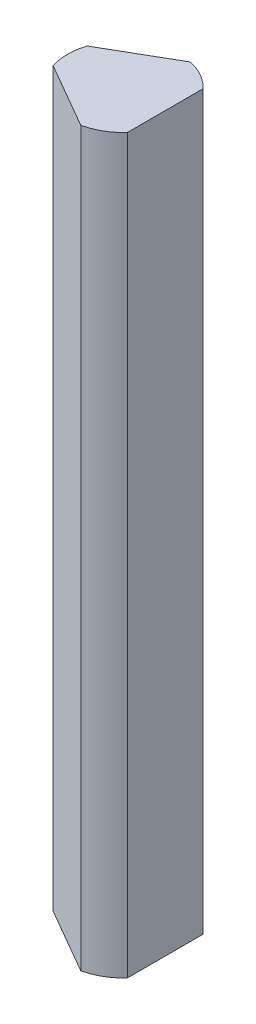
from build123d import *

# Parameters (mm, degrees)
RESSALTO_EXTRUS_O1_DEPTH = 30


with BuildPart() as part:
    # Esboço1 → Ressalto-extrusão1 (new body)
    with BuildSketch(Plane(origin=(0, 0, 0), x_dir=(1, 0, 0), z_dir=(0, 1, 0))):
        with BuildLine():
            Line((0.491640786, -2.246839856), (-2.191640786, -0.697646517))
            ThreePointArc((-2.191640786, -0.697646517), (-2.3, 0), (-2.191640786, 0.697646517))
            Line((-2.191640786, 0.697646517), (0.491640786, 2.246839856))
            ThreePointArc((0.491640786, 2.246839856), (1.15, 1.991858429), (1.7, 1.549193338))
            Line((1.7, 1.549193338), (1.7, -1.549193338))
            ThreePointArc((1.7, -1.549193338), (1.15, -1.991858429), (0.491640786, -2.246839856))
        make_face()
    extrude(amount=RESSALTO_EXTRUS_O1_DEPTH)


solid = part.part
